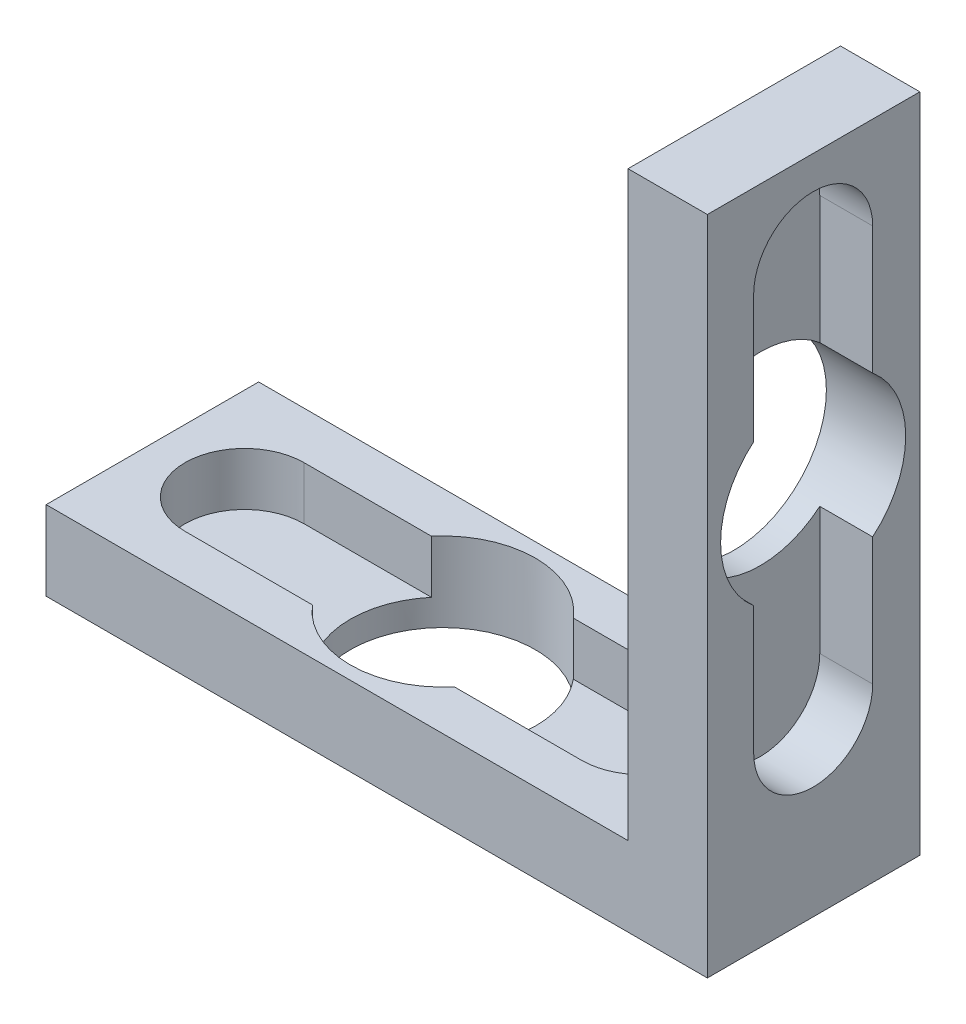
from build123d import *

# Parameters (mm, degrees)
SKETCH_1_W          = 25
SKETCH_1_H          = 8.033880903
EXTRUDE_1_DEPTH     = 3
SKETCH_2_W          = 3
SKETCH_2_H          = 8.033880903
EXTRUDE_2_DEPTH     = 22
SKETCH_3_R          = 3.5
CUT_EXTRUDE_1_DEPTH = 3
SKETCH_4_W          = 15
SKETCH_4_H          = 4.5
CUT_EXTRUDE_2_DEPTH = 2
SKETCH_5_R          = 2.25
CUT_EXTRUDE_3_DEPTH = 2
SKETCH_6_R          = 3.5
CUT_EXTRUDE_4_DEPTH = 3
SKETCH_7_W          = 4.5
SKETCH_7_H          = 15
CUT_EXTRUDE_5_DEPTH = 2
SKETCH_8_R          = 2.25
CUT_EXTRUDE_6_DEPTH = 2


with BuildPart() as part:
    # 草图1 → 凸台-拉伸1 (new body)
    with BuildSketch(Plane(origin=(0, 0, 0), x_dir=(1, 0, 0), z_dir=(0, 1, 0))):
        with Locations((12.5, -4.016940452)):
            Rectangle(SKETCH_1_W, SKETCH_1_H)
    extrude(amount=EXTRUDE_1_DEPTH)

    # 草图2 → 凸台-拉伸2 (add)
    with BuildSketch(Plane(origin=(0, 3, 0), x_dir=(1, 0, 0), z_dir=(0, 1, 0))):
        with Locations((23.5, -4.016940452)):
            Rectangle(SKETCH_2_W, SKETCH_2_H)
    extrude(amount=EXTRUDE_2_DEPTH)

    # 草图3 → 切除-拉伸1 (cut)
    with BuildSketch(Plane(origin=(0, 3, 0), x_dir=(1, 0, 0), z_dir=(0, 1, 0))):
        with Locations(Location((11, -4.033880903, 0), (0, 0, 270))):
            Circle(SKETCH_3_R)
    extrude(amount=-CUT_EXTRUDE_1_DEPTH, mode=Mode.SUBTRACT)

    # 草图4 → 切除-拉伸2 (cut)
    with BuildSketch(Plane(origin=(0, 3, 0), x_dir=(1, 0, 0), z_dir=(0, 1, 0))):
        with Locations((11, -4.033880903)):
            Rectangle(SKETCH_4_W, SKETCH_4_H)
    extrude(amount=-CUT_EXTRUDE_2_DEPTH, mode=Mode.SUBTRACT)

    # 草图5 → 切除-拉伸3 (cut)
    with BuildSketch(Plane(origin=(0, 3, 0), x_dir=(1, 0, 0), z_dir=(0, 1, 0))):
        with Locations((18.5, -4.033880903)):
            Circle(SKETCH_5_R)
        with Locations((3.5, -4.033880903)):
            Circle(SKETCH_5_R)
    extrude(amount=-CUT_EXTRUDE_3_DEPTH, mode=Mode.SUBTRACT)

    # 草图6 → 切除-拉伸4 (cut)
    with BuildSketch(Plane(origin=(25, 0, 0), x_dir=(0, 0, -1), z_dir=(1, 0, 0))):
        with Locations((-4.033880903, 14)):
            Circle(SKETCH_6_R)
    extrude(amount=-CUT_EXTRUDE_4_DEPTH, mode=Mode.SUBTRACT)

    # 草图7 → 切除-拉伸5 (cut)
    with BuildSketch(Plane(origin=(25, 0, 0), x_dir=(0, 0, -1), z_dir=(1, 0, 0))):
        with Locations((-4.033880903, 14)):
            Rectangle(SKETCH_7_W, SKETCH_7_H)
    extrude(amount=-CUT_EXTRUDE_5_DEPTH, mode=Mode.SUBTRACT)

    # 草图8 → 切除-拉伸6 (cut)
    with BuildSketch(Plane(origin=(25, 0, 0), x_dir=(0, 0, -1), z_dir=(1, 0, 0))):
        with Locations((-4.033880903, 6.5)):
            Circle(SKETCH_8_R)
        with Locations((-4.033880903, 21.5)):
            Circle(SKETCH_8_R)
    extrude(amount=-CUT_EXTRUDE_6_DEPTH, mode=Mode.SUBTRACT)


solid = part.part
